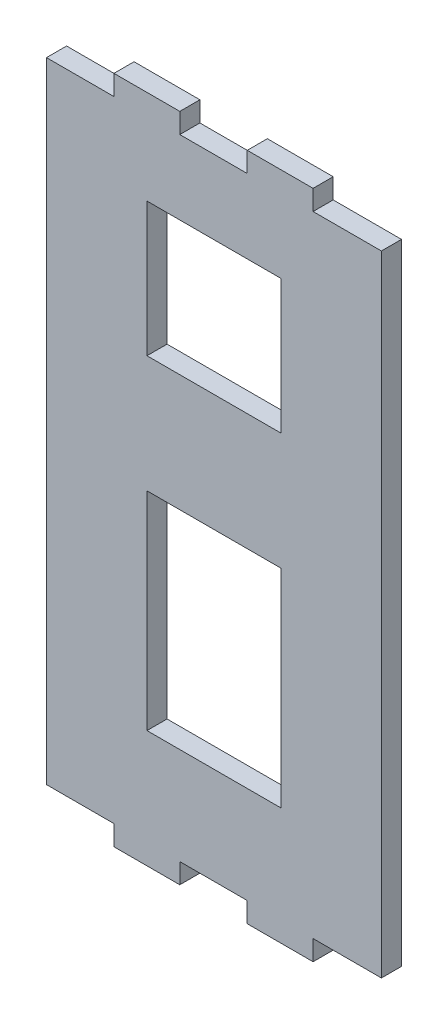
from build123d import *

# Parameters (mm, degrees)
ESQUISSE1_W             = 50
ESQUISSE1_H             = 100
BOSS_EXTRU_1_DEPTH      = 3
ESQUISSE3_W             = 20
ESQUISSE3_H             = 20
ESQUISSE3_H_2           = 31
ENL_V_MAT_EXTRU_2_DEPTH = 3
ESQUISSE5_W             = 10.07
ESQUISSE5_H             = 3
ENL_V_MAT_EXTRU_3_DEPTH = 3
ESQUISSE6_W             = 0.13
ESQUISSE6_H             = 3
ENL_V_MAT_EXTRU_4_DEPTH = 3


with BuildPart() as part:
    # Esquisse1 → Boss.-Extru.1 (new body)
    with BuildSketch(Plane.XY):
        with Locations((25, 50)):
            Rectangle(ESQUISSE1_W, ESQUISSE1_H)
    extrude(amount=BOSS_EXTRU_1_DEPTH)

    # Esquisse3 → Enlèv. mat.-Extru.2 (cut)
    with BuildSketch(Plane.XY.offset(3)):
        with Locations((25, 75.953744756)):
            Rectangle(ESQUISSE3_W, ESQUISSE3_H)
        with Locations((25, 32.989712488)):
            Rectangle(ESQUISSE3_W, ESQUISSE3_H_2)
    extrude(amount=-ENL_V_MAT_EXTRU_2_DEPTH, mode=Mode.SUBTRACT)

    # Esquisse5 → Enlèv. mat.-Extru.3 (cut)
    with BuildSketch(Plane.XY.offset(3)):
        with Locations((24.935, 98.5)):
            Rectangle(ESQUISSE5_W, ESQUISSE5_H)
        with Locations((5.035, 98.5)):
            Rectangle(ESQUISSE5_W, ESQUISSE5_H)
        with Locations((44.835, 98.5)):
            Rectangle(ESQUISSE5_W, ESQUISSE5_H)
        with Locations((24.935, 1.5)):
            Rectangle(ESQUISSE5_W, ESQUISSE5_H)
        with Locations((44.835, 1.5)):
            Rectangle(ESQUISSE5_W, ESQUISSE5_H)
        with Locations((5.035, 1.5)):
            Rectangle(ESQUISSE5_W, ESQUISSE5_H)
    extrude(amount=-ENL_V_MAT_EXTRU_3_DEPTH, mode=Mode.SUBTRACT)

    # Esquisse6 → Enlèv. mat.-Extru.4 (cut)
    with BuildSketch(Plane.XY.offset(3)):
        with Locations((49.935, 98.5)):
            Rectangle(ESQUISSE6_W, ESQUISSE6_H)
        with Locations((49.935, 1.5)):
            Rectangle(ESQUISSE6_W, ESQUISSE6_H)
    extrude(amount=-ENL_V_MAT_EXTRU_4_DEPTH, mode=Mode.SUBTRACT)


solid = part.part
